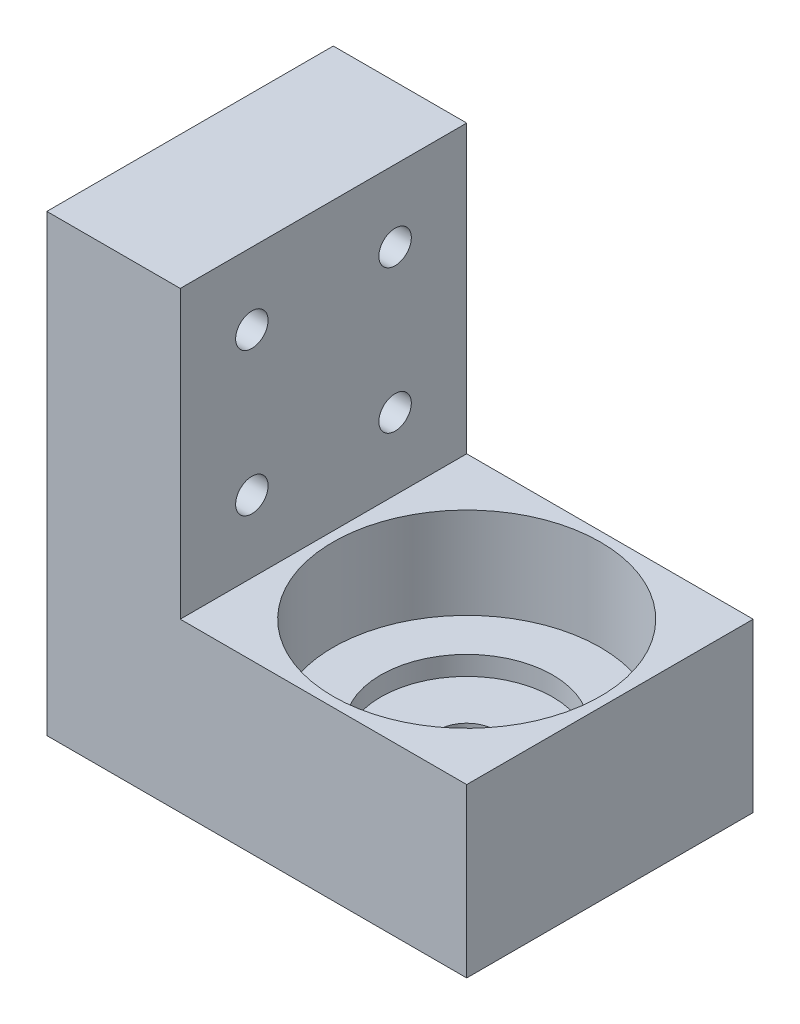
from build123d import *

# Parameters (mm, degrees)
SKETCH3_W           = 30
SKETCH3_H           = 30
BOSS_EXTRUDE2_DEPTH = 17.544106429
SKETCH8_R           = 14
CUT_EXTRUDE1_DEPTH  = 9.554
SKETCH9_R           = 9
CUT_EXTRUDE2_DEPTH  = 2
SKETCH10_R          = 3
CUT_EXTRUDE3_DEPTH  = 44.971523922
SKETCH13_W          = 30
SKETCH13_H          = 47.544106429
BOSS_EXTRUDE3_DEPTH = 13.972846029
SKETCH14_R          = 1.7
CUT_EXTRUDE4_DEPTH  = 64.721598035


with BuildPart() as part:
    # Sketch3 → Boss-Extrude2 (new body)
    with BuildSketch(Plane(origin=(0, 0, 0), x_dir=(1, 0, 0), z_dir=(0, 1, 0))):
        with Locations((15, 15)):
            Rectangle(SKETCH3_W, SKETCH3_H)
    extrude(amount=BOSS_EXTRUDE2_DEPTH)

    # Sketch8 → Cut-Extrude1 (cut)
    with BuildSketch(Plane(origin=(0, 17.544106429, 0), x_dir=(1, 0, 0), z_dir=(0, 1, 0))):
        with Locations(Location((15, 15, 0), (0, 0, 270))):
            Circle(SKETCH8_R)
    extrude(amount=-CUT_EXTRUDE1_DEPTH, mode=Mode.SUBTRACT)

    # Sketch9 → Cut-Extrude2 (cut)
    with BuildSketch(Plane(origin=(0, 7.990106429, 0), x_dir=(1, 0, 0), z_dir=(0, 1, 0))):
        with Locations(Location((15, 15, 0), (0, 0, 270))):
            Circle(SKETCH9_R)
    extrude(amount=-CUT_EXTRUDE2_DEPTH, mode=Mode.SUBTRACT)

    # Sketch10 → Cut-Extrude3 (cut, through all)
    with BuildSketch(Plane(origin=(0, 5.990106429, 0), x_dir=(1, 0, 0), z_dir=(0, 1, 0))):
        with Locations(Location((15, 15, 0), (0, 0, 270))):
            Circle(SKETCH10_R)
    extrude(amount=-CUT_EXTRUDE3_DEPTH, mode=Mode.SUBTRACT)

    # Sketch13 → Boss-Extrude3 (add)
    with BuildSketch(Plane.ZY):
        with Locations((-15, 23.772053215)):
            Rectangle(SKETCH13_W, SKETCH13_H)
    extrude(amount=BOSS_EXTRUDE3_DEPTH)

    # Sketch14 → Cut-Extrude4 (cut, through all)
    with BuildSketch(Plane(origin=(0, 0, 0), x_dir=(0, 0, -1), z_dir=(1, 0, 0))):
        with Locations((7.5, 25.054)):
            Circle(SKETCH14_R)
        with Locations((7.5, 40.054)):
            Circle(SKETCH14_R)
        with Locations((22.5, 25.054)):
            Circle(SKETCH14_R)
        with Locations((22.5, 40.054)):
            Circle(SKETCH14_R)
    extrude(amount=-CUT_EXTRUDE4_DEPTH, mode=Mode.SUBTRACT)


solid = part.part
